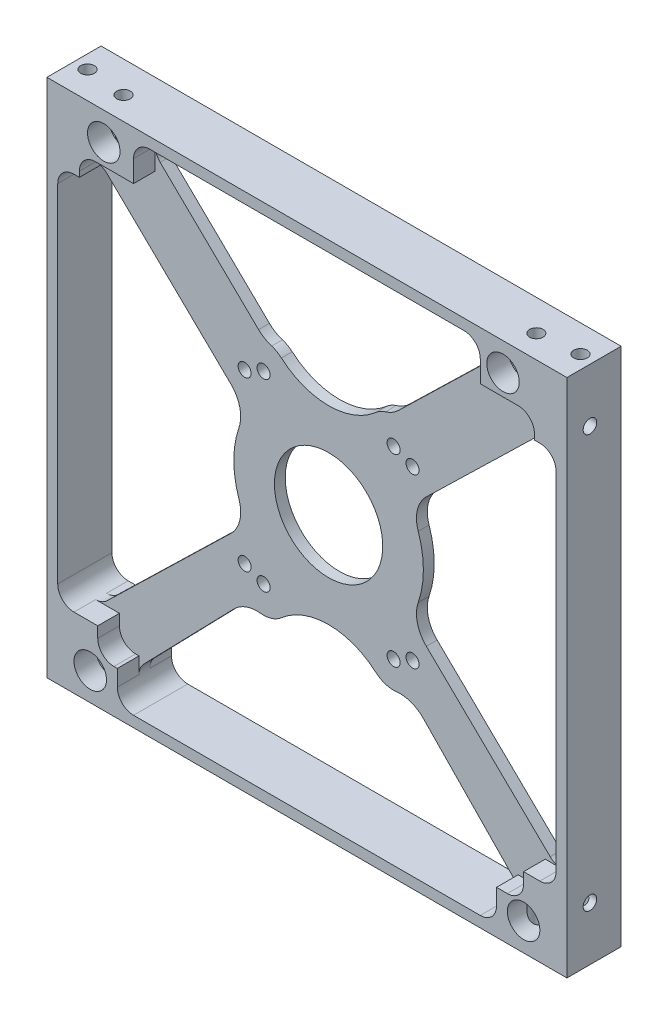
from build123d import *

# Parameters (mm, degrees)
SKETCH1_W                              = 96
SKETCH1_H                              = 96
SKETCH1_W_2                            = 84
SKETCH1_H_2                            = 84
BOSS_EXTRUDE1_DEPTH                    = 10
SKETCH5_W                              = 9
SKETCH5_H                              = 3.65
SKETCH5_W_2                            = 1.3
SKETCH5_W_3                            = 6.5
BOSS_EXTRUDE2_DEPTH                    = 10
FILLET1_R                              = 3
M3_CLEARANCE_HOLE1_D                   = 3.4
SKETCH9_R                              = 3
CUT_EXTRUDE1_DEPTH                     = 4
M3_TAPPED_HOLE2_AT_2_COUNT             = 2
M3_TAPPED_HOLE2_AT_2_PITCH             = 91
BOSS_EXTRUDE3_DEPTH                    = 10
CUT_EXTRUDE2_DEPTH                     = 10
FILLET2_R                              = 3
M3_TAPPED_HOLE3_AT_2_COUNT             = 2
M3_TAPPED_HOLE3_AT_2_PITCH             = 76.2
CIRPATTERN1_COUNT                      = 4
BOSS_EXTRUDE4_DEPTH                    = 1
BOSS_EXTRUDE4_DEPTH_BACK               = 1
CUT_EXTRUDE3_START                     = -11
SKETCH22_R                             = 10
CUT_EXTRUDE3_DEPTH                     = 12
FILLET3_R                              = 6
CIRPATTERN2_COUNT                      = 2
CIRPATTERN2_ANGLE                      = 90
FILLET3_OF_CIRPATTERN2_R               = 6
CIRPATTERN2_THE_OTHER_WAY_COUNT        = 2
CIRPATTERN2_THE_OTHER_WAY_ANGLE        = 90
FILLET3_OF_CIRPATTERN2_THE_OTHER_WAY_R = 6
CUT_EXTRUDE4_DEPTH                     = 10
M2_CLEARANCE_HOLE1_D                   = 2.4
M2_CLEARANCE_HOLE1_DEPTH               = 7.5
M2_CLEARANCE_HOLE1_TIP                 = 0.721032743
BOSS_EXTRUDE6_DEPTH                    = 2
FILLET5_R                              = 6
CIRPATTERN8_COUNT                      = 2
FILLET6_R                              = 6
M2_CLEARANCE_HOLE2_D                   = 2.4
M2_CLEARANCE_HOLE2_DEPTH               = 7.5
M2_CLEARANCE_HOLE2_TIP                 = 0.721032743


with BuildPart() as part:
    # Sketch1 → Boss-Extrude1 (new body)
    with BuildSketch(Plane.XY):
        Rectangle(SKETCH1_W, SKETCH1_H)
        Rectangle(SKETCH1_W_2, SKETCH1_H_2, mode=Mode.SUBTRACT)
    extrude(amount=BOSS_EXTRUDE1_DEPTH)

    # Sketch5 → Boss-Extrude2 (add)
    with BuildSketch(Plane.XY.offset(10)):
        with Locations((36.2, 40.175)):
            Rectangle(SKETCH5_W, SKETCH5_H)
        with Locations((41.35, 40.175)):
            Rectangle(SKETCH5_W_2, SKETCH5_H)
        with Locations((-37.5, 40.175)):
            Rectangle(SKETCH5_W, SKETCH5_H)
        with Locations((-38.75, -40.175)):
            Rectangle(SKETCH5_W_3, SKETCH5_H)
        with Locations((38.75, -40.175)):
            Rectangle(SKETCH5_W_3, SKETCH5_H)
    extrude(amount=-BOSS_EXTRUDE2_DEPTH)

    # Fillet1
    fillet1_edges = [part.edges().sort_by_distance(p)[0] for p in [
        (42, 38.35, 5),
        (31.7, 42, 5),
        (-42, 38.35, 5),
        (-33, 42, 5),
        (-35.5, -42, 5),
        (-42, -38.35, 5),
        (42, -38.35, 5),
        (35.5, -42, 5),
    ]]
    fillet(fillet1_edges, radius=FILLET1_R)

    # M3 Clearance Hole1 (through all)
    with Locations(Plane(origin=(36.2, 42.85, 0), x_dir=(-1, 0, 0), z_dir=(0, 0, -1))):
        with Locations((0, 0), (73.7, 0), (76.2, -85.7), (-3.8, -85.7)):
            Hole(M3_CLEARANCE_HOLE1_D / 2)

    # Sketch9 → Cut-Extrude1 (cut)
    with BuildSketch(Plane.XY.offset(10)):
        with Locations((-37.5, 42.85)):
            Circle(SKETCH9_R)
        with Locations((36.2, 42.85)):
            Circle(SKETCH9_R)
        with Locations((-40, -42.85)):
            Circle(SKETCH9_R)
        with Locations((40, -42.85)):
            Circle(SKETCH9_R)
    extrude(amount=-CUT_EXTRUDE1_DEPTH, mode=Mode.SUBTRACT)

    # Sketch15 → M3 Tapped Hole2 (revolve, cut)
    with BuildSketch(Plane(origin=(45.5, -48, 5), x_dir=(0, 0, -1), z_dir=(1, 0, 0))):
        Polygon((0, 0), (0, 10.251075774), (1.25, 9.5), (1.25, 0), align=None)
    m3_tapped_hole2 = revolve(axis=Axis((45.5, -54.35, 5), (0, 1, 0)), mode=Mode.SUBTRACT)

    # M3 Tapped Hole2 at 2: M3 Tapped Hole2 ×2
    with Locations(*[(-i * M3_TAPPED_HOLE2_AT_2_PITCH, 0, 0) for i in range(1, M3_TAPPED_HOLE2_AT_2_COUNT)]):
        add(m3_tapped_hole2, mode=Mode.SUBTRACT)

    # Mirror2: M3 Tapped Hole2 across plane
    add(m3_tapped_hole2.mirror(Plane.ZX), mode=Mode.SUBTRACT)

    # Mirror2 copy 1 sketch → Mirror2 copy 1 (revolve, cut)
    with BuildSketch(Plane(origin=(-45.5, 48, 5), x_dir=(0, 0, -1), z_dir=(1, 0, 0))):
        Polygon((0, 0), (0, -10.251075774), (1.25, -9.5), (1.25, 0), align=None)
    revolve(axis=Axis((-45.5, 54.35, 5), (0, 1, 0)), mode=Mode.SUBTRACT)

    # Sketch19 → Boss-Extrude3 (add)
    with BuildSketch(Plane(origin=(0, 0, 0), x_dir=(-1, 0, 0), z_dir=(0, 0, -1))):
        with BuildLine():
            Line((-32.5, -42), (32.5, -42))
            ThreePointArc((32.5, -42), (34.621320344, -41.121320344), (35.5, -39))
            Line((35.5, -39), (35.5, -38.35))
            Line((35.5, -38.35), (39, -38.35))
            ThreePointArc((39, -38.35), (41.121320344, -37.471320344), (42, -35.35))
            Line((42, -35.35), (42, 35.35))
            ThreePointArc((42, 35.35), (41.121320344, 37.471320344), (39, 38.35))
            Line((39, 38.35), (33, 38.35))
            Line((33, 38.35), (33, 39))
            ThreePointArc((33, 39), (32.121320344, 41.121320344), (30, 42))
            Line((30, 42), (-28.7, 42))
            ThreePointArc((-28.7, 42), (-30.821320344, 41.121320344), (-31.7, 39))
            Line((-31.7, 39), (-31.7, 38.35))
            Line((-31.7, 38.35), (-39, 38.35))
            ThreePointArc((-39, 38.35), (-41.121320344, 37.471320344), (-42, 35.35))
            Line((-42, 35.35), (-42, -35.35))
            ThreePointArc((-42, -35.35), (-41.121320344, -37.471320344), (-39, -38.35))
            Line((-39, -38.35), (-35.5, -38.35))
            Line((-35.5, -38.35), (-35.5, -39))
            ThreePointArc((-35.5, -39), (-34.621320344, -41.121320344), (-32.5, -42))
        make_face()
    extrude(amount=-BOSS_EXTRUDE3_DEPTH)

    # Sketch18 → Cut-Extrude2 (cut)
    with BuildSketch(Plane(origin=(0, 0, 0), x_dir=(-1, 0, 0), z_dir=(0, 0, -1))):
        with BuildLine():
            Line((-35, -46), (35, -46))
            Line((35, -46), (35, -40))
            Line((35, -40), (35, -35))
            Line((35, -35), (35, 35))
            Line((35, 35), (32, 35))
            Line((32, 35), (32, 39))
            Line((32, 39), (32, 43))
            ThreePointArc((32, 43), (31.121320344, 45.121320344), (29, 46))
            Line((29, 46), (-21.13732092, 46))
            Line((-21.13732092, 46), (-21.13732092, 35))
            Line((-21.13732092, 35), (-32, 35))
            Line((-32, 35), (-35, 35))
            Line((-35, 35), (-35, -35))
            Line((-35, -35), (-35, -40))
            Line((-35, -40), (-35, -46))
        make_face()
        with BuildLine():
            Line((-32, 39), (-32, 35))
            Line((-32, 35), (-21.13732092, 35))
            Line((-21.13732092, 35), (-21.13732092, 46))
            Line((-21.13732092, 46), (-29, 46))
            ThreePointArc((-29, 46), (-31.121320344, 45.121320344), (-32, 43))
            Line((-32, 43), (-32, 39))
        make_face()
        with BuildLine():
            Line((38.614874983, -35), (43, -35))
            ThreePointArc((43, -35), (45.121320344, -34.121320344), (46, -32))
            Line((46, -32), (46, 32))
            ThreePointArc((46, 32), (45.121320344, 34.121320344), (43, 35))
            Line((43, 35), (42, 35))
            Line((42, 35), (35, 35))
            Line((35, 35), (35, -35))
            Line((35, -35), (38.614874983, -35))
        make_face()
        with BuildLine():
            Line((-40, -35), (-35, -35))
            Line((-35, -35), (-35, 35))
            Line((-35, 35), (-42, 35))
            Line((-42, 35), (-43, 35))
            ThreePointArc((-43, 35), (-45.121320344, 34.121320344), (-46, 32))
            Line((-46, 32), (-46, -32))
            ThreePointArc((-46, -32), (-45.121320344, -34.121320344), (-43, -35))
            Line((-43, -35), (-40, -35))
        make_face()
        with BuildLine():
            Line((35, -35), (35, -40))
            Line((35, -40), (35.614874983, -40))
            ThreePointArc((35.614874983, -40), (37.736195326, -39.121320344), (38.614874983, -37))
            Line((38.614874983, -37), (38.614874983, -35))
            Line((38.614874983, -35), (35, -35))
        make_face()
        with BuildLine():
            Line((-37, -40), (-35, -40))
            Line((-35, -40), (-35, -35))
            Line((-35, -35), (-40, -35))
            Line((-40, -35), (-40, -37))
            ThreePointArc((-40, -37), (-39.121320344, -39.121320344), (-37, -40))
        make_face()
        with BuildLine():
            Line((32, 35), (32, 39))
            Line((32, 39), (39, 39))
            ThreePointArc((39, 39), (41.121320344, 38.121320344), (42, 36))
            Line((42, 36), (42, 35))
            Line((42, 35), (32, 35))
        make_face()
        with BuildLine():
            Line((-32, 35), (-32, 39))
            Line((-32, 39), (-39, 39))
            ThreePointArc((-39, 39), (-41.121320344, 38.121320344), (-42, 36))
            Line((-42, 36), (-42, 35))
            Line((-42, 35), (-32, 35))
        make_face()
    extrude(amount=-CUT_EXTRUDE2_DEPTH, mode=Mode.SUBTRACT)

    # Fillet2
    fillet2_edges = [part.edges().sort_by_distance(p)[0] for p in [
        (-35, -46, 5),
        (35, -46, 5),
    ]]
    fillet(fillet2_edges, radius=FILLET2_R)

    # Sketch20 → M3 Tapped Hole3 (revolve, cut)
    with BuildSketch(Plane(origin=(-48, -38.099998017, 5.75199932), x_dir=(0, 0, 1), z_dir=(0, 1, 0))):
        Polygon((0, 0), (0, 8.251075774), (1.25, 7.5), (1.25, 0), align=None)
    m3_tapped_hole3 = revolve(axis=Axis((-54.35, -38.099998017, 5.75199932), (1, 0, 0)), mode=Mode.SUBTRACT)

    # M3 Tapped Hole3 at 2: M3 Tapped Hole3 ×2
    with Locations(*[(0, i * M3_TAPPED_HOLE3_AT_2_PITCH, 0) for i in range(1, M3_TAPPED_HOLE3_AT_2_COUNT)]):
        add(m3_tapped_hole3, mode=Mode.SUBTRACT)

    # CirPattern1: M3 Tapped Hole3 ×4 about axis
    cirpattern1_axis = Axis((0, 0, -0.5), (0, 0, 1))
    for i in range(1, CIRPATTERN1_COUNT):
        add(m3_tapped_hole3.rotate(cirpattern1_axis, i * 360 / CIRPATTERN1_COUNT), mode=Mode.SUBTRACT)

    # CirPattern1 copy 1 sketch → CirPattern1 copy 1 (revolve, cut)
    with BuildSketch(Plane(origin=(-38.100001983, -48, 5.75199932), x_dir=(0, 0, 1), z_dir=(-1, 0, 0))):
        Polygon((0, 0), (0, 8.251075774), (1.25, 7.5), (1.25, 0), align=None)
    revolve(axis=Axis((-38.100001983, -54.35, 5.75199932), (0, 1, 0)), mode=Mode.SUBTRACT)

    # CirPattern1 copy 2 sketch → CirPattern1 copy 2 (revolve, cut)
    with BuildSketch(Plane(origin=(48, -38.100001983, 5.75199932), x_dir=(0, 0, 1), z_dir=(0, -1, 0))):
        Polygon((0, 0), (0, 8.251075774), (1.25, 7.5), (1.25, 0), align=None)
    revolve(axis=Axis((54.35, -38.100001983, 5.75199932), (-1, 0, 0)), mode=Mode.SUBTRACT)

    # CirPattern1 copy 3 sketch → CirPattern1 copy 3 (revolve, cut)
    with BuildSketch(Plane(origin=(38.100001983, 48, 5.75199932), x_dir=(0, 0, 1), z_dir=(1, 0, 0))):
        Polygon((0, 0), (0, 8.251075774), (1.25, 7.5), (1.25, 0), align=None)
    revolve(axis=Axis((38.100001983, 54.35, 5.75199932), (0, -1, 0)), mode=Mode.SUBTRACT)

    # Sketch21 → Boss-Extrude4 (add, two sides: drawn at the far end of the back side and taken through both)
    with BuildSketch(Plane(origin=(0, 0, 5), x_dir=(-1, 0, 0), z_dir=(0, 0, -1)).offset(-BOSS_EXTRUDE4_DEPTH_BACK)):
        with BuildLine():
            Line((46, -32), (46, 32))
            ThreePointArc((46, 32), (45.121320344, 34.121320344), (43, 35))
            Line((43, 35), (42, 35))
            Line((42, 35), (42, 36))
            ThreePointArc((42, 36), (41.121320344, 38.121320344), (39, 39))
            Line((39, 39), (32, 39))
            Line((32, 39), (32, 43))
            ThreePointArc((32, 43), (31.121320344, 45.121320344), (29, 46))
            Line((29, 46), (-29, 46))
            ThreePointArc((-29, 46), (-31.121320344, 45.121320344), (-32, 43))
            Line((-32, 43), (-32, 39))
            Line((-32, 39), (-39, 39))
            ThreePointArc((-39, 39), (-41.121320344, 38.121320344), (-42, 36))
            Line((-42, 36), (-42, 35))
            Line((-42, 35), (-43, 35))
            ThreePointArc((-43, 35), (-45.121320344, 34.121320344), (-46, 32))
            Line((-46, 32), (-46, -32))
            ThreePointArc((-46, -32), (-45.121320344, -34.121320344), (-43, -35))
            Line((-43, -35), (-40, -35))
            Line((-40, -35), (-40, -37))
            ThreePointArc((-40, -37), (-39.121320344, -39.121320344), (-37, -40))
            Line((-37, -40), (-35, -40))
            Line((-35, -40), (-35, -43))
            ThreePointArc((-35, -43), (-34.121320344, -45.121320344), (-32, -46))
            Line((-32, -46), (32, -46))
            ThreePointArc((32, -46), (34.121320344, -45.121320344), (35, -43))
            Line((35, -43), (35, -40))
            Line((35, -40), (35.614874983, -40))
            ThreePointArc((35.614874983, -40), (37.736195326, -39.121320344), (38.614874983, -37))
            Line((38.614874983, -37), (38.614874983, -35))
            Line((38.614874983, -35), (43, -35))
            ThreePointArc((43, -35), (45.121320344, -34.121320344), (46, -32))
        make_face()
    extrude(amount=BOSS_EXTRUDE4_DEPTH + BOSS_EXTRUDE4_DEPTH_BACK)

    # Sketch22 → Cut-Extrude3 (cut)
    with BuildSketch(Plane(origin=(0, 0, 4), x_dir=(-1, 0, 0), z_dir=(0, 0, -1)).offset(CUT_EXTRUDE3_START)):
        with BuildLine():
            ThreePointArc((8.999330804, -15.008732294), (0, -17.5), (-8.999330804, -15.008732294))
            Line((-8.999330804, -15.008732294), (-34.152186012, -40.910001108))
            ThreePointArc((-34.152186012, -40.910001108), (-34.763150075, -44.168332856), (-32, -46))
            Line((-32, -46), (32, -46))
            ThreePointArc((32, -46), (34.763150075, -44.168332856), (34.152186012, -40.910001108))
            Line((34.152186012, -40.910001108), (8.999330804, -15.008732294))
        make_face()
        Circle(SKETCH22_R)
    cut_extrude3 = extrude(amount=CUT_EXTRUDE3_DEPTH, mode=Mode.SUBTRACT)

    # Fillet3
    fillet3_edges = [part.edges().sort_by_distance(p)[0] for p in [
        (-8.999330804, -15.008732294, 5),
        (8.999330804, -15.008732294, 5),
    ]]
    fillet(fillet3_edges, radius=FILLET3_R)

    # CirPattern2: Cut-Extrude3 ×2 about axis
    cirpattern2_axis = Axis((0, 0, 0), (0, 0, 1))
    for i in range(1, CIRPATTERN2_COUNT):
        add(cut_extrude3.rotate(cirpattern2_axis, i * CIRPATTERN2_ANGLE / (CIRPATTERN2_COUNT - 1)), mode=Mode.SUBTRACT)

    # Fillet3 of CirPattern2
    fillet3_of_cirpattern2_edges = [part.edges().sort_by_distance(p)[0] for p in [
        (15.008732294, -8.999330804, 5),
        (15.008732294, 8.999330804, 5),
    ]]
    fillet(fillet3_of_cirpattern2_edges, radius=FILLET3_OF_CIRPATTERN2_R)

    # CirPattern2 the other way: Cut-Extrude3 ×2 about axis
    cirpattern2_the_other_way_axis = Axis((0, 0, 0), (0, 0, -1))
    for i in range(1, CIRPATTERN2_THE_OTHER_WAY_COUNT):
        add(cut_extrude3.rotate(cirpattern2_the_other_way_axis, i * CIRPATTERN2_THE_OTHER_WAY_ANGLE / (CIRPATTERN2_THE_OTHER_WAY_COUNT - 1)), mode=Mode.SUBTRACT)

    # Fillet3 of CirPattern2 the other way
    fillet3_of_cirpattern2_the_other_way_edges = [part.edges().sort_by_distance(p)[0] for p in [
        (-15.008732294, 8.999330804, 5),
        (-15.008732294, -8.999330804, 5),
    ]]
    fillet(fillet3_of_cirpattern2_the_other_way_edges, radius=FILLET3_OF_CIRPATTERN2_THE_OTHER_WAY_R)

    # Sketch23 → Cut-Extrude4 (cut)
    with BuildSketch(Plane(origin=(0, 0, 4), x_dir=(-1, 0, 0), z_dir=(0, 0, -1))):
        with BuildLine():
            ThreePointArc((31.089998892, 40.847813988), (26.220021759, 41.872293929), (29, 46))
            Line((29, 46), (-29, 46))
            ThreePointArc((-29, 46), (-26.878679656, 45.121320344), (-26, 43))
            ThreePointArc((-26, 43), (-27.831667144, 40.236849925), (-31.089998892, 40.847813988))
            Line((-31.089998892, 40.847813988), (-7.640057844, 18.075455766))
            ThreePointArc((-7.640057844, 18.075455766), (-5.926173512, 17.091578768), (-3.950435881, 17.048286024))
            ThreePointArc((-3.950435881, 17.048286024), (0, 17.5), (3.950435881, 17.048286024))
            ThreePointArc((3.950435881, 17.048286024), (5.926173512, 17.091578768), (7.640057844, 18.075455766))
            Line((7.640057844, 18.075455766), (31.089998892, 40.847813988))
        make_face()
        with BuildLine():
            ThreePointArc((32, 43), (31.121320344, 45.121320344), (29, 46))
            ThreePointArc((29, 46), (26.220021759, 41.872293929), (31.089998892, 40.847813988))
            ThreePointArc((31.089998892, 40.847813988), (31.763150075, 41.831667144), (32, 43))
        make_face()
        with BuildLine():
            ThreePointArc((-26, 43), (-26.878679656, 45.121320344), (-29, 46))
            ThreePointArc((-29, 46), (-31.121320344, 45.121320344), (-32, 43))
            ThreePointArc((-32, 43), (-31.763150075, 41.831667144), (-31.089998892, 40.847813988))
            ThreePointArc((-31.089998892, 40.847813988), (-27.831667144, 40.236849925), (-26, 43))
        make_face()
    extrude(amount=-CUT_EXTRUDE4_DEPTH, mode=Mode.SUBTRACT)

    # M2 Clearance Hole1
    with Locations(Plane(origin=(-15.5, -15.5, 4), x_dir=(-1, 0, 0), z_dir=(0, 0, -1))):
        with Locations((0, 0), (-31, 0), (-31, 31), (0, 31)):
            Hole(M2_CLEARANCE_HOLE1_D / 2, depth=M2_CLEARANCE_HOLE1_DEPTH)
            with Locations((0, 0, -(M2_CLEARANCE_HOLE1_DEPTH + M2_CLEARANCE_HOLE1_TIP / 2))):  # 118° drill point
                Cone(0, M2_CLEARANCE_HOLE1_D / 2, M2_CLEARANCE_HOLE1_TIP, mode=Mode.SUBTRACT)

    # Sketch24 → Boss-Extrude6 (add)
    with BuildSketch(Plane(origin=(0, 0, 4), x_dir=(-1, 0, 0), z_dir=(0, 0, -1))):
        with BuildLine():
            ThreePointArc((7.056340553, -16.251514011), (7.305707404, -18.721515909), (8.712328767, -20.767123288))
            ThreePointArc((8.712328767, -20.767123288), (11.748883076, -21.993690047), (14.893167831, -21.077938192))
            Line((14.893167831, -21.077938192), (11.945842788, -18.042916618))
            ThreePointArc((11.945842788, -18.042916618), (9.705561543, -16.589129772), (7.056340553, -16.251514011))
        make_face()
        with BuildLine():
            Line((-11.945842788, -18.042916618), (-14.893167831, -21.077938192))
            ThreePointArc((-14.893167831, -21.077938192), (-11.748883076, -21.993690047), (-8.712328767, -20.767123288))
            ThreePointArc((-8.712328767, -20.767123288), (-7.305707404, -18.721515909), (-7.056340553, -16.251514011))
            ThreePointArc((-7.056340553, -16.251514011), (-9.705561543, -16.589129772), (-11.945842788, -18.042916618))
        make_face()
        with BuildLine():
            ThreePointArc((-7.056340553, -16.251514011), (-7.305707404, -18.721515909), (-8.712328767, -20.767123288))
            ThreePointArc((-8.712328767, -20.767123288), (-4.652385601, -18.343638397), (0, -17.5))
            ThreePointArc((0, -17.5), (-2.884689829, -17.260607307), (-5.690456953, -16.548978811))
            ThreePointArc((-5.690456953, -16.548978811), (-6.364706122, -16.360332033), (-7.056340553, -16.251514011))
        make_face()
        with BuildLine():
            ThreePointArc((5.690456953, -16.548978811), (2.884689829, -17.260607307), (0, -17.5))
            ThreePointArc((0, -17.5), (4.652385601, -18.343638397), (8.712328767, -20.767123288))
            ThreePointArc((8.712328767, -20.767123288), (7.305707404, -18.721515909), (7.056340553, -16.251514011))
            ThreePointArc((7.056340553, -16.251514011), (6.364706122, -16.360332033), (5.690456953, -16.548978811))
        make_face()
    boss_extrude6 = extrude(amount=-BOSS_EXTRUDE6_DEPTH)

    # Fillet5
    fillet5_edges = [part.edges().sort_by_distance(p)[0] for p in [
        (14.893167831, -21.077938192, 5),
        (-14.893167831, -21.077938192, 5),
    ]]
    fillet(fillet5_edges, radius=FILLET5_R)

    # CirPattern8: Boss-Extrude6 ×2 about axis
    cirpattern8_axis = Axis((0, 0, 0), (0, 0, 1))
    for i in range(1, CIRPATTERN8_COUNT):
        add(boss_extrude6.rotate(cirpattern8_axis, i * 360 / CIRPATTERN8_COUNT))

    # Fillet6
    fillet6_edges = [part.edges().sort_by_distance(p)[0] for p in [
        (-11.670160024, 21.989108697, 5),
        (11.670160024, 21.989108697, 5),
    ]]
    fillet(fillet6_edges, radius=FILLET6_R)

    # M2 Clearance Hole2
    with Locations(Plane(origin=(-12, -17, 4), x_dir=(-1, 0, 0), z_dir=(0, 0, -1))):
        with Locations((0, 0), (-24, 0), (-24, 34), (0, 34)):
            Hole(M2_CLEARANCE_HOLE2_D / 2, depth=M2_CLEARANCE_HOLE2_DEPTH)
            with Locations((0, 0, -(M2_CLEARANCE_HOLE2_DEPTH + M2_CLEARANCE_HOLE2_TIP / 2))):  # 118° drill point
                Cone(0, M2_CLEARANCE_HOLE2_D / 2, M2_CLEARANCE_HOLE2_TIP, mode=Mode.SUBTRACT)


solid = part.part
